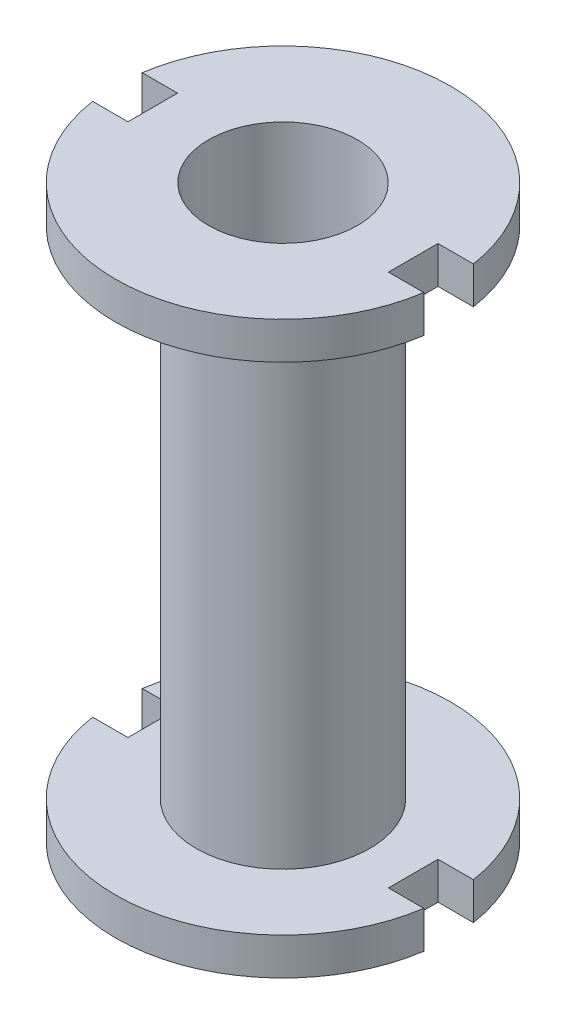
from build123d import *

# Parameters (mm, degrees)
SKETCH_1_R          = 6.75
SKETCH_1_R_2        = 3
EXTRUDE_1_DEPTH     = 11.5
SKETCH_2_R          = 11.31533916
SKETCH_2_R_2        = 3.5
CUT_EXTRUDE_1_DEPTH = 10
SKETCH_4_W          = 3
SKETCH_4_H          = 2
CUT_EXTRUDE_2_DEPTH = 25.90230913


with BuildPart() as part:
    # 草图1 → 凸台-拉伸1 (new, symmetric)
    with BuildSketch(Plane(origin=(0, 0, 0), x_dir=(1, 0, 0), z_dir=(0, 1, 0))):
        with Locations(Location((0, 0, 0), (0, 0, 270))):
            Circle(SKETCH_1_R)
        with Locations(Location((0, 0, 0), (0, 0, 270))):
            Circle(SKETCH_1_R_2, mode=Mode.SUBTRACT)
    extrude(amount=EXTRUDE_1_DEPTH, both=True)

    # 草图2 → 切除-拉伸1 (cut, symmetric)
    with BuildSketch(Plane(origin=(0, 0, 0), x_dir=(1, 0, 0), z_dir=(0, 1, 0))):
        Circle(SKETCH_2_R)
        with Locations(Location((0, 0, 0), (0, 0, 270))):
            Circle(SKETCH_2_R_2, mode=Mode.SUBTRACT)
    extrude(amount=CUT_EXTRUDE_1_DEPTH, both=True, mode=Mode.SUBTRACT)

    # 草图4 → 切除-拉伸2 (cut, through all)
    with BuildSketch(Plane(origin=(0, 11.5, 0), x_dir=(1, 0, 0), z_dir=(0, 1, 0))):
        with Locations((-6.75, 0)):
            Rectangle(SKETCH_4_W, SKETCH_4_H)
        with Locations((6.75, 0)):
            Rectangle(SKETCH_4_W, SKETCH_4_H)
    extrude(amount=-CUT_EXTRUDE_2_DEPTH, mode=Mode.SUBTRACT)


solid = part.part
